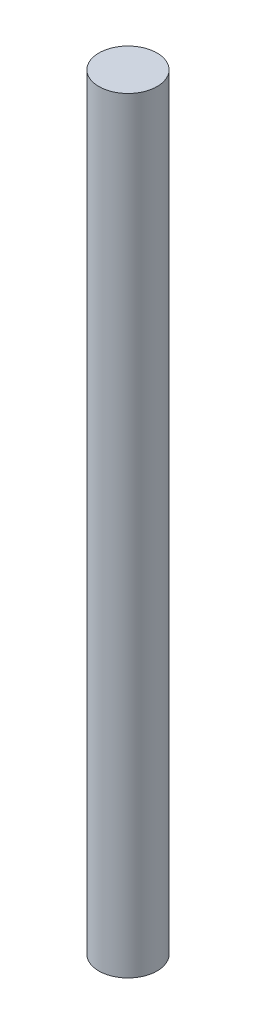
from build123d import *

# Parameters (mm, degrees)
SKETCH_1_R      = 3
EXTRUDE_1_DEPTH = 79


with BuildPart() as part:
    # 草图1 → 凸台-拉伸1 (new body)
    with BuildSketch(Plane(origin=(0, 0, 0), x_dir=(1, 0, 0), z_dir=(0, 1, 0))):
        with Locations(Location((0, 0, 0), (0, 0, 270))):
            Circle(SKETCH_1_R)
    extrude(amount=EXTRUDE_1_DEPTH)


solid = part.part
